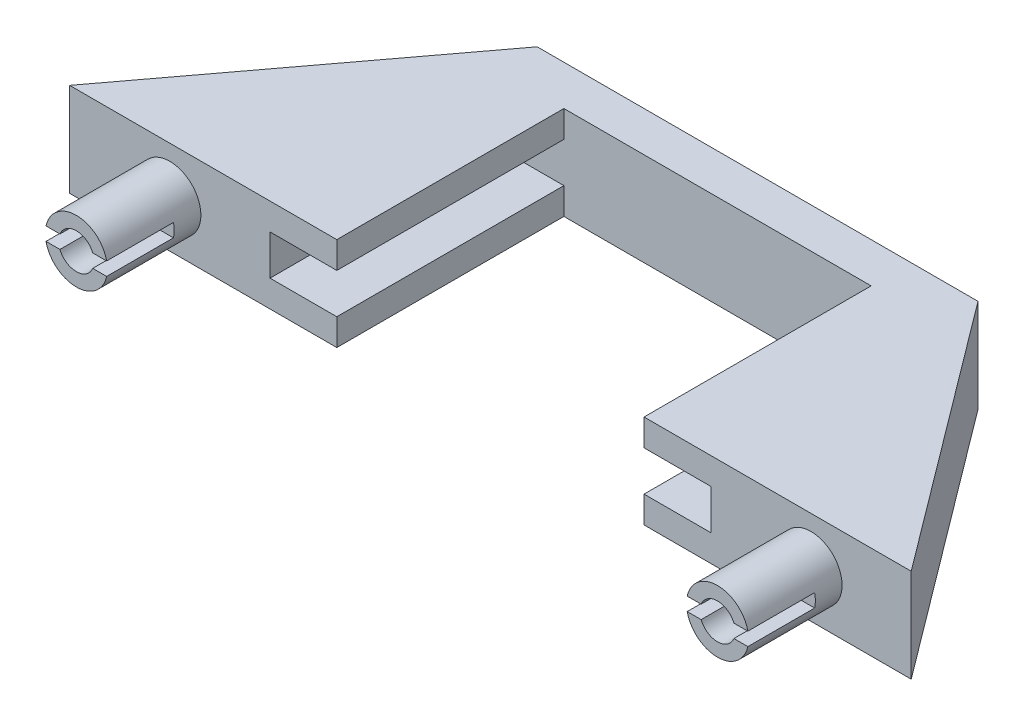
from build123d import *

# Parameters (mm, degrees)
SKETCH1_W           = 33
SKETCH1_H           = 7
BOSS_EXTRUDE1_DEPTH = 3
SKETCH2_W           = 5
SKETCH2_H           = 2
BOSS_EXTRUDE2_DEPTH = 17
BOSS_EXTRUDE3_DEPTH = 7
SKETCH4_R           = 2.325
BOSS_EXTRUDE4_DEPTH = 7
SKETCH5_R           = 1.325
CUT_EXTRUDE1_DEPTH  = 7
SKETCH6_W           = 9.664864402
SKETCH6_H           = 1
SKETCH6_W_2         = 10.163169966
CUT_EXTRUDE2_DEPTH  = 5


with BuildPart() as part:
    # Sketch1 → Boss-Extrude1 (new body)
    with BuildSketch(Plane.XY):
        Rectangle(SKETCH1_W, SKETCH1_H)
    extrude(amount=BOSS_EXTRUDE1_DEPTH)

    # Sketch2 → Boss-Extrude2 (add)
    with BuildSketch(Plane.XY.offset(3)):
        with Locations((-14, 2.5)):
            Rectangle(SKETCH2_W, SKETCH2_H)
        with Locations((-14, -2.5)):
            Rectangle(SKETCH2_W, SKETCH2_H)
        with Locations((14, -2.5)):
            Rectangle(SKETCH2_W, SKETCH2_H)
        with Locations((14, 2.5)):
            Rectangle(SKETCH2_W, SKETCH2_H)
    extrude(amount=BOSS_EXTRUDE2_DEPTH)

    # Sketch3 → Boss-Extrude3 (add)
    with BuildSketch(Plane(origin=(0, 3.5, 0), x_dir=(1, 0, 0), z_dir=(0, 1, 0))):
        Polygon((-16.5, -20), (-31.5, -20), (-16.5, 0), align=None)
        Polygon((16.5, -20), (31.5, -20), (16.5, 0), align=None)
    extrude(amount=-BOSS_EXTRUDE3_DEPTH)

    # Sketch4 → Boss-Extrude4 (add)
    with BuildSketch(Plane.XY.offset(20)):
        with Locations((24, 0)):
            Circle(SKETCH4_R)
        with Locations((-24, 0)):
            Circle(SKETCH4_R)
    extrude(amount=BOSS_EXTRUDE4_DEPTH)

    # Sketch5 → Cut-Extrude1 (cut)
    with BuildSketch(Plane.XY.offset(27)):
        with Locations((-24, 0)):
            Circle(SKETCH5_R)
        with Locations((24, 0)):
            Circle(SKETCH5_R)
    extrude(amount=-CUT_EXTRUDE1_DEPTH, mode=Mode.SUBTRACT)

    # Sketch6 → Cut-Extrude2 (cut)
    with BuildSketch(Plane.XY.offset(27)):
        with Locations((-26.325, 0)):
            Rectangle(SKETCH6_W, SKETCH6_H)
        with Locations((26.325, 0)):
            Rectangle(SKETCH6_W_2, SKETCH6_H)
    extrude(amount=-CUT_EXTRUDE2_DEPTH, mode=Mode.SUBTRACT)


solid = part.part
